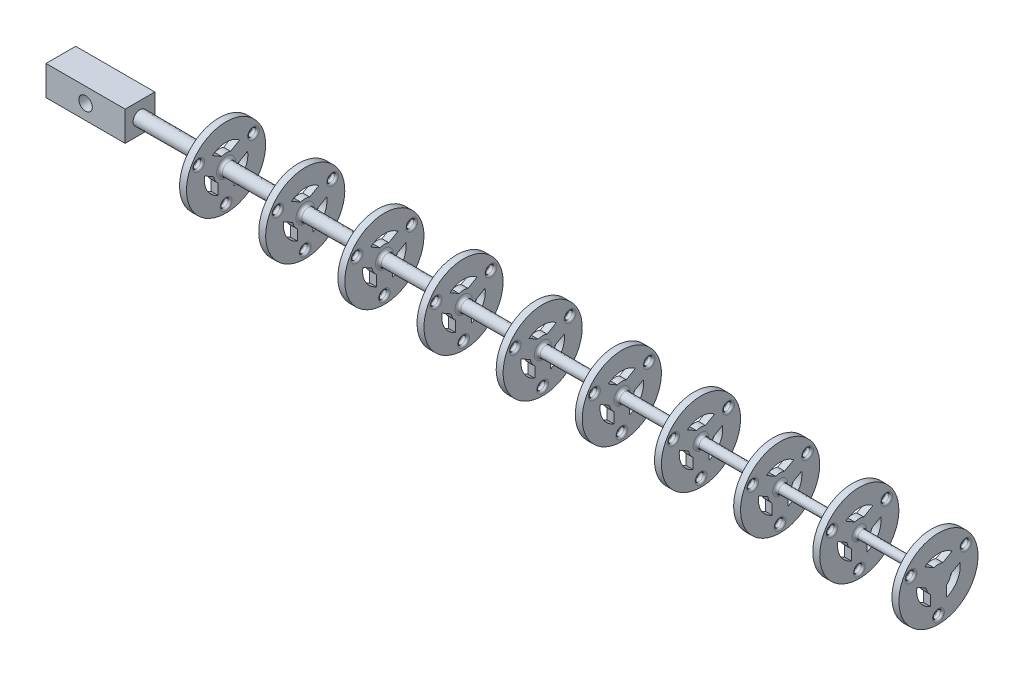
from build123d import *

# Parameters (mm, degrees)
SKETCH3_W                      = 1.75
SKETCH3_H                      = 10
CUT_EXTRUDE1_REACH             = 180.81
SKETCH5_R                      = 1
FILLET1_R                      = 0.5
LPATTERN1_COUNT                = 10
LPATTERN1_PITCH                = 20
FILLET1_OF_LPATTERN1_R         = 0.5
SKETCH16_W                     = 7.5
SKETCH16_H                     = 7.5
BOSS_EXTRUDE1_DEPTH            = 20
M3_CLEARANCE_HOLE1_D           = 3.4
M3_CLEARANCE_HOLE1_CSINK_D     = 3.45
M3_CLEARANCE_HOLE1_CSINK_ANGLE = 90
FILLET2_R                      = 0.75


with BuildPart() as part:
    # Sketch2 → Revolve1 (revolve)
    with BuildSketch(Plane.XY):
        Polygon((0, 1.75), (200, 1), (200, 0), (0, 0), align=None)
    revolve(axis=Axis((200, 0, 0), (-1, 0, 0)))

    # Sketch3 → Revolve2 (revolve)
    with BuildSketch(Plane.XY):
        with Locations((20.875, 5)):
            Rectangle(SKETCH3_W, SKETCH3_H)
    revolve2 = revolve(axis=Axis((21.75, 0, 0), (-1, 0, 0)))

    # Sketch5 → Cut-Extrude1 (cut, up to next)
    with BuildSketch(Plane(origin=(21.75, 0, 0), x_dir=(0, 0, -1), z_dir=(1, 0, 0)), mode=Mode.PRIVATE) as cut_extrude1_sk1:
        with Locations((0, -8)):
            Circle(SKETCH5_R)
    cut_extrude1_tool1 = extrude(cut_extrude1_sk1.sketch, amount=-CUT_EXTRUDE1_REACH, mode=Mode.PRIVATE) & part.part
    # Sketch5 → Cut-Extrude1 (cut, up to next)
    with BuildSketch(Plane(origin=(21.75, 0, 0), x_dir=(0, 0, -1), z_dir=(1, 0, 0)), mode=Mode.PRIVATE) as cut_extrude1_sk2:
        with Locations((6.92820323, 4)):
            Circle(SKETCH5_R)
    cut_extrude1_tool2 = extrude(cut_extrude1_sk2.sketch, amount=-CUT_EXTRUDE1_REACH, mode=Mode.PRIVATE) & part.part
    # Sketch5 → Cut-Extrude1 (cut, up to next)
    with BuildSketch(Plane(origin=(21.75, 0, 0), x_dir=(0, 0, -1), z_dir=(1, 0, 0)), mode=Mode.PRIVATE) as cut_extrude1_sk3:
        with Locations((-6.92820323, 4)):
            Circle(SKETCH5_R)
    cut_extrude1_tool3 = extrude(cut_extrude1_sk3.sketch, amount=-CUT_EXTRUDE1_REACH, mode=Mode.PRIVATE) & part.part
    # Sketch5 → Cut-Extrude1 (cut, up to next)
    with BuildSketch(Plane(origin=(21.75, 0, 0), x_dir=(0, 0, -1), z_dir=(1, 0, 0)), mode=Mode.PRIVATE) as cut_extrude1_sk4:
        with BuildLine():
            Line((-3.437059837, 4.293788499), (-1.128202797, 2.960769265))
            ThreePointArc((-1.128202797, 2.960769265), (0, 3.1684375), (1.128202797, 2.960769265))
            Line((1.128202797, 2.960769265), (3.437059837, 4.293788499))
            ThreePointArc((3.437059837, 4.293788499), (0, 5.5), (-3.437059837, 4.293788499))
        make_face()
    cut_extrude1_tool4 = extrude(cut_extrude1_sk4.sketch, amount=-CUT_EXTRUDE1_REACH, mode=Mode.PRIVATE) & part.part
    # Sketch5 → Cut-Extrude1 (cut, up to next)
    with BuildSketch(Plane(origin=(21.75, 0, 0), x_dir=(0, 0, -1), z_dir=(1, 0, 0)), mode=Mode.PRIVATE) as cut_extrude1_sk5:
        with BuildLine():
            Line((2, -2.457436915), (2, -5.123475383))
            ThreePointArc((2, -5.123475383), (4.763139721, -2.75), (5.437059837, 0.829686884))
            Line((5.437059837, 0.829686884), (3.128202797, -0.50333235))
            ThreePointArc((3.128202797, -0.50333235), (2.743947365, -1.58421875), (2, -2.457436915))
        make_face()
    cut_extrude1_tool5 = extrude(cut_extrude1_sk5.sketch, amount=-CUT_EXTRUDE1_REACH, mode=Mode.PRIVATE) & part.part
    # Sketch5 → Cut-Extrude1 (cut, up to next)
    with BuildSketch(Plane(origin=(21.75, 0, 0), x_dir=(0, 0, -1), z_dir=(1, 0, 0)), mode=Mode.PRIVATE) as cut_extrude1_sk6:
        with BuildLine():
            Line((-3.128202797, -0.50333235), (-5.437059837, 0.829686884))
            ThreePointArc((-5.437059837, 0.829686884), (-4.763139721, -2.75), (-2, -5.123475383))
            Line((-2, -5.123475383), (-2, -2.457436915))
            ThreePointArc((-2, -2.457436915), (-2.743947365, -1.58421875), (-3.128202797, -0.50333235))
        make_face()
    cut_extrude1_tool6 = extrude(cut_extrude1_sk6.sketch, amount=-CUT_EXTRUDE1_REACH, mode=Mode.PRIVATE) & part.part
    cut_extrude1_1 = cut_extrude1_tool1.solids().sort_by_distance((21.75, -8, 0))[0]
    add(cut_extrude1_1, mode=Mode.SUBTRACT)
    cut_extrude1_2 = cut_extrude1_tool2.solids().sort_by_distance((21.75, 4, -6.928203))[0]
    add(cut_extrude1_2, mode=Mode.SUBTRACT)
    cut_extrude1_3 = cut_extrude1_tool3.solids().sort_by_distance((21.75, 4, 6.928203))[0]
    add(cut_extrude1_3, mode=Mode.SUBTRACT)
    cut_extrude1_4 = cut_extrude1_tool4.solids().sort_by_distance((21.75, 4.274526, 0))[0]
    add(cut_extrude1_4, mode=Mode.SUBTRACT)
    cut_extrude1_5 = cut_extrude1_tool5.solids().sort_by_distance((21.75, -2.137263, -3.701848))[0]
    add(cut_extrude1_5, mode=Mode.SUBTRACT)
    cut_extrude1_6 = cut_extrude1_tool6.solids().sort_by_distance((21.75, -2.137263, 3.701848))[0]
    add(cut_extrude1_6, mode=Mode.SUBTRACT)
    cut_extrude1 = cut_extrude1_1 + cut_extrude1_2 + cut_extrude1_3 + cut_extrude1_4 + cut_extrude1_5 + cut_extrude1_6  # Cut-Extrude1 as one shape, for the pattern or mirror that repeats it

    # Fillet1
    fillet1_edges = [part.edges().sort_by_distance(p)[0] for p in [
        (20, 4, -5.92820323),
        (20, -8, 1),
        (21.75, -8, 1),
        (21.75, 4, -5.92820323),
        (20, 4, 7.92820323),
        (21.75, 4, 7.92820323),
    ]]
    fillet(fillet1_edges, radius=FILLET1_R)

    # LPattern1: Revolve2, Cut-Extrude1 ×10
    with Locations(*[(i * LPATTERN1_PITCH, 0, 0) for i in range(1, LPATTERN1_COUNT)]):
        add(revolve2)
        add(cut_extrude1, mode=Mode.SUBTRACT)

    # Fillet1 of LPattern1
    fillet1_of_lpattern1_edges = [part.edges().sort_by_distance(p)[0] for p in [
        (40, 4, -5.92820323),
        (40, -8, 1),
        (41.75, -8, 1),
        (41.75, 4, -5.92820323),
        (40, 4, 7.92820323),
        (41.75, 4, 7.92820323),
        (60, 4, -5.92820323),
        (60, -8, 1),
        (61.75, -8, 1),
        (61.75, 4, -5.92820323),
        (60, 4, 7.92820323),
        (61.75, 4, 7.92820323),
        (80, 4, -5.92820323),
        (80, -8, 1),
        (81.75, -8, 1),
        (81.75, 4, -5.92820323),
        (80, 4, 7.92820323),
        (81.75, 4, 7.92820323),
        (100, 4, -5.92820323),
        (100, -8, 1),
        (101.75, -8, 1),
        (101.75, 4, -5.92820323),
        (100, 4, 7.92820323),
        (101.75, 4, 7.92820323),
        (120, 4, -5.92820323),
        (120, -8, 1),
        (121.75, -8, 1),
        (121.75, 4, -5.92820323),
        (120, 4, 7.92820323),
        (121.75, 4, 7.92820323),
        (140, 4, -5.92820323),
        (140, -8, 1),
        (141.75, -8, 1),
        (141.75, 4, -5.92820323),
        (140, 4, 7.92820323),
        (141.75, 4, 7.92820323),
        (160, 4, -5.92820323),
        (160, -8, 1),
        (161.75, -8, 1),
        (161.75, 4, -5.92820323),
        (160, 4, 7.92820323),
        (161.75, 4, 7.92820323),
        (180, 4, -5.92820323),
        (180, -8, 1),
        (181.75, -8, 1),
        (181.75, 4, -5.92820323),
        (180, 4, 7.92820323),
        (181.75, 4, 7.92820323),
        (200, 4, -5.92820323),
        (200, -8, 1),
        (201.75, -8, 1),
        (201.75, 4, -5.92820323),
        (200, 4, 7.92820323),
        (201.75, 4, 7.92820323),
    ]]
    fillet(fillet1_of_lpattern1_edges, radius=FILLET1_OF_LPATTERN1_R)

    # Sketch16 → Boss-Extrude1 (add)
    with BuildSketch(Plane.ZY):
        Rectangle(SKETCH16_W, SKETCH16_H)
    extrude(amount=BOSS_EXTRUDE1_DEPTH)

    # M3 Clearance Hole1 (through all)
    with Locations(Plane(origin=(0, 0, -3.75), x_dir=(-1, 0, 0), z_dir=(0, 0, -1))):
        with Locations((10, 0)):
            CounterSinkHole(M3_CLEARANCE_HOLE1_D / 2, M3_CLEARANCE_HOLE1_CSINK_D / 2, counter_sink_angle=M3_CLEARANCE_HOLE1_CSINK_ANGLE)

    # Fillet2
    fillet2_edges = [part.edges().sort_by_distance(p)[0] for p in [
        (20, -1.675, 0),
        (21.75, -1.6684375, 0),
        (40, -1.6, 0),
        (41.75, -1.5934375, 0),
        (60, -1.525, 0),
        (61.75, -1.5184375, 0),
        (80, -1.45, 0),
        (81.75, -1.4434375, 0),
        (100, -1.375, 0),
        (101.75, -1.3684375, 0),
        (120, -1.3, 0),
        (121.75, -1.2934375, 0),
        (140, -1.225, 0),
        (141.75, -1.2184375, 0),
        (160, -1.15, 0),
        (161.75, -1.1434375, 0),
        (180, -1.075, 0),
        (181.75, -1.0684375, 0),
        (200, -1, 0),
    ]]
    fillet(fillet2_edges, radius=FILLET2_R)


solid = part.part
